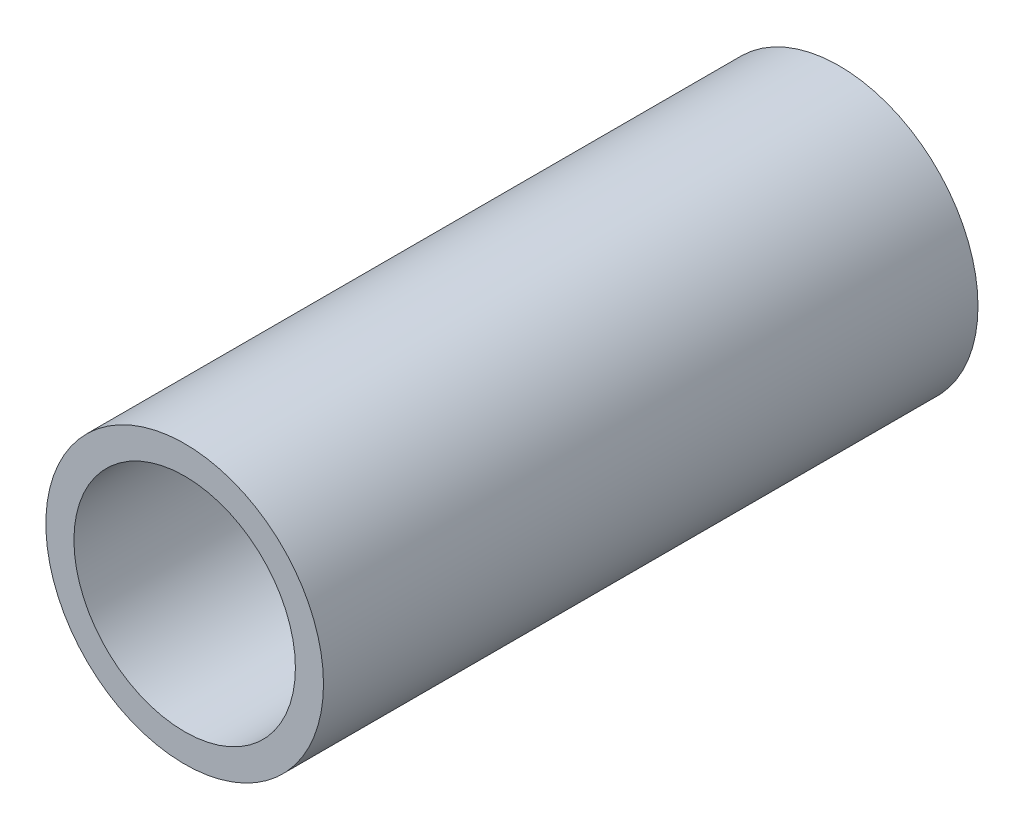
from build123d import *

# Parameters (mm, degrees)
SKETCH1_R           = 16.7005
SKETCH1_R_2         = 13.3223
EXTRUDE_THIN1_DEPTH = 39.37


with BuildPart() as part:
    # Sketch1 → Extrude-Thin1 (new, symmetric)
    with BuildSketch(Plane.XY):
        Circle(SKETCH1_R)
        Circle(SKETCH1_R_2, mode=Mode.SUBTRACT)
    extrude(amount=EXTRUDE_THIN1_DEPTH, both=True)


solid = part.part
